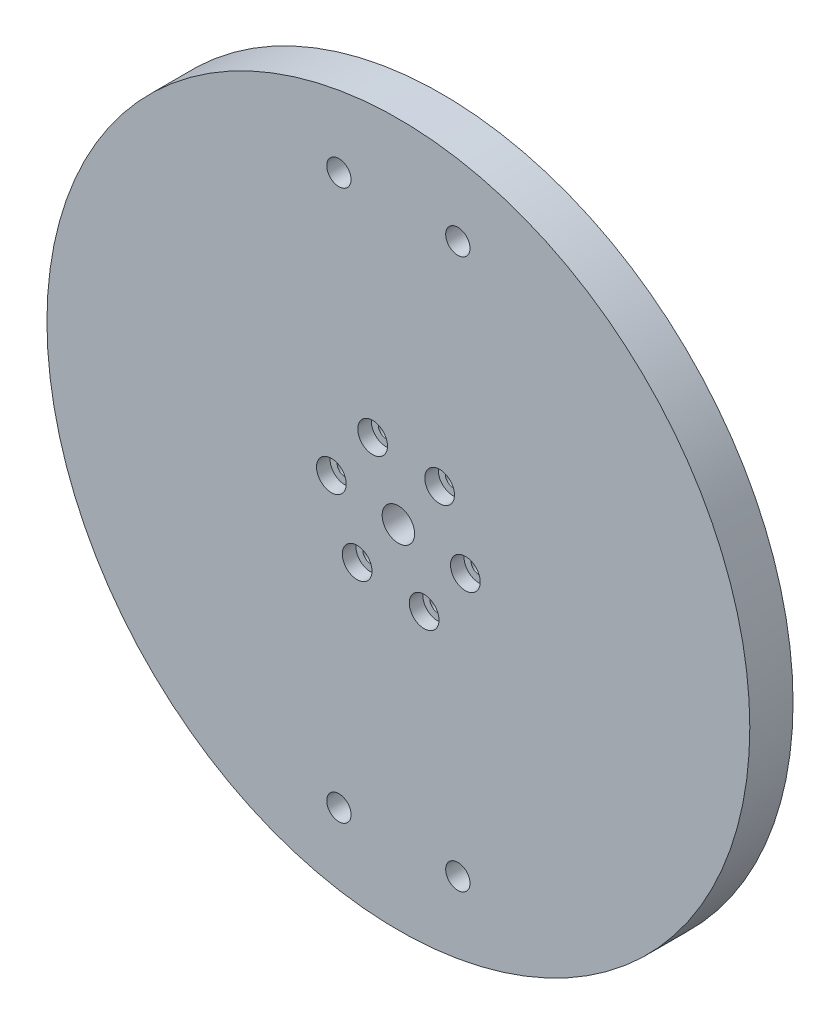
from build123d import *

# Parameters (mm, degrees)
DISCO_START                         = 70
SK_DISCO_R                          = 65
DISCO_DEPTH                         = 8
CENTRADOR_ARANDELA_EJE_51110_START  = 67
SK_CENTRADOR_ARANDELA_EJE_51110_R   = 24.9
SK_CENTRADOR_ARANDELA_EJE_51110_R_2 = 23
CENTRADOR_ARANDELA_EJE_51110_DEPTH  = 3
PASANTES_M2_5_ROTOR_J1_START        = 70
SK_PASANTES_M2_5_ROTOR_J1_R         = 1.45
PASANTES_M2_5_ROTOR_J1_DEPTH        = 8
CAJAS_M2_5_START                    = 75.5
SK_CAJAS_M2_5_R                     = 2.75
CAJAS_M2_5_DEPTH                    = 2.5
PASO_CABLE_START                    = 70
SK_PASO_CABLE_R                     = 3
PASO_CABLE_DEPTH                    = 8
PASANTES_M4_ANGULOS_START           = 70
SK_PASANTES_M4_ANGULOS_R            = 2.25
PASANTES_M4_ANGULOS_DEPTH           = 8


with BuildPart() as part:
    # Sk_Disco → Disco (new body)
    with BuildSketch(Plane.XY.offset(DISCO_START)):
        Circle(SK_DISCO_R)
    extrude(amount=DISCO_DEPTH)

    # Sk_Centrador_arandela_eje_51110 → Centrador_arandela_eje_51110 (add)
    with BuildSketch(Plane.XY.offset(CENTRADOR_ARANDELA_EJE_51110_START)):
        Circle(SK_CENTRADOR_ARANDELA_EJE_51110_R)
        Circle(SK_CENTRADOR_ARANDELA_EJE_51110_R_2, mode=Mode.SUBTRACT)
    extrude(amount=CENTRADOR_ARANDELA_EJE_51110_DEPTH)

    # Sk_Pasantes_M2-5_rotor_J1 → Pasantes_M2-5_rotor_J1 (cut)
    with BuildSketch(Plane.XY.offset(PASANTES_M2_5_ROTOR_J1_START)):
        with Locations((12.390194253, -1.653204878)):
            Circle(SK_PASANTES_M2_5_ROTOR_J1_R)
        with Locations((7.626814549, 9.903620542)):
            Circle(SK_PASANTES_M2_5_ROTOR_J1_R)
        with Locations((-4.763379704, 11.55682542)):
            Circle(SK_PASANTES_M2_5_ROTOR_J1_R)
        with Locations((-12.390194253, 1.653204878)):
            Circle(SK_PASANTES_M2_5_ROTOR_J1_R)
        with Locations((-7.626814549, -9.903620542)):
            Circle(SK_PASANTES_M2_5_ROTOR_J1_R)
        with Locations((4.763379704, -11.55682542)):
            Circle(SK_PASANTES_M2_5_ROTOR_J1_R)
    extrude(amount=PASANTES_M2_5_ROTOR_J1_DEPTH, mode=Mode.SUBTRACT)

    # Sk_Cajas_M2-5 → Cajas_M2-5 (cut)
    with BuildSketch(Plane.XY.offset(CAJAS_M2_5_START)):
        with Locations((12.390194253, -1.653204878)):
            Circle(SK_CAJAS_M2_5_R)
        with Locations((7.626814549, 9.903620542)):
            Circle(SK_CAJAS_M2_5_R)
        with Locations((-4.763379704, 11.55682542)):
            Circle(SK_CAJAS_M2_5_R)
        with Locations((-12.390194253, 1.653204878)):
            Circle(SK_CAJAS_M2_5_R)
        with Locations((-7.626814549, -9.903620542)):
            Circle(SK_CAJAS_M2_5_R)
        with Locations((4.763379704, -11.55682542)):
            Circle(SK_CAJAS_M2_5_R)
    extrude(amount=CAJAS_M2_5_DEPTH, mode=Mode.SUBTRACT)

    # Sk_Paso_cable → Paso_cable (cut)
    with BuildSketch(Plane.XY.offset(PASO_CABLE_START)):
        Circle(SK_PASO_CABLE_R)
    extrude(amount=PASO_CABLE_DEPTH, mode=Mode.SUBTRACT)

    # Sk_Pasantes_M4_angulos → Pasantes_M4_angulos (cut)
    with BuildSketch(Plane.XY.offset(PASANTES_M4_ANGULOS_START)):
        with Locations((-11, -50.86)):
            Circle(SK_PASANTES_M4_ANGULOS_R)
        with Locations((-11, 50.86)):
            Circle(SK_PASANTES_M4_ANGULOS_R)
        with Locations((11, -50.86)):
            Circle(SK_PASANTES_M4_ANGULOS_R)
        with Locations((11, 50.86)):
            Circle(SK_PASANTES_M4_ANGULOS_R)
    extrude(amount=PASANTES_M4_ANGULOS_DEPTH, mode=Mode.SUBTRACT)


solid = part.part
